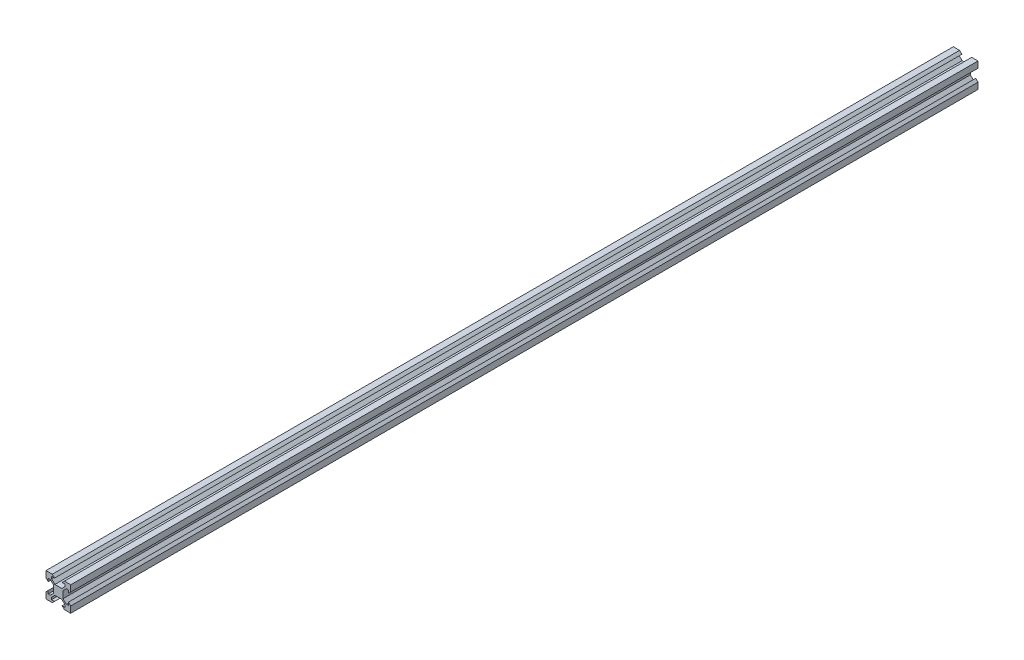
from build123d import *

# Parameters (mm, degrees)
SKETCH1_W           = 20
SKETCH1_H           = 20
BOSS_EXTRUDE1_DEPTH = 735.01
CUT_EXTRUDE1_DEPTH  = 736.554008962


with BuildPart() as part:
    # Sketch1 → Boss-Extrude1 (new body)
    with BuildSketch(Plane.XY):
        with Locations((10, 10)):
            Rectangle(SKETCH1_W, SKETCH1_H)
    extrude(amount=BOSS_EXTRUDE1_DEPTH)

    # Sketch2 → Cut-Extrude1 (cut, through all)
    with BuildSketch(Plane.XY.offset(735.01)):
        Polygon((4.5, 18.18), (6.94, 18.18), (5.12, 20), (14.88, 20), (13.06, 18.18), (15.5, 18.18), (15.5, 16.475807358), (12.834192642, 13.81), (7.165807358, 13.81), (4.5, 16.475807358), align=None)
        Polygon((14.88, 0), (13.06, 1.82), (15.5, 1.82), (15.5, 3.524192642), (12.834192642, 6.19), (7.165807358, 6.19), (4.5, 3.524192642), (4.5, 1.82), (6.94, 1.82), (5.12, 0), align=None)
        Polygon((1.82, 4.5), (1.82, 6.94), (0, 5.12), (0, 14.88), (1.82, 13.06), (1.82, 15.5), (3.524192642, 15.5), (6.19, 12.834192642), (6.19, 7.165807358), (3.524192642, 4.5), align=None)
        Polygon((20, 14.88), (18.18, 13.06), (18.18, 15.5), (16.475807358, 15.5), (13.81, 12.834192642), (13.81, 7.165807358), (16.475807358, 4.5), (18.18, 4.5), (18.18, 6.94), (20, 5.12), align=None)
    extrude(amount=-CUT_EXTRUDE1_DEPTH, mode=Mode.SUBTRACT)


solid = part.part
